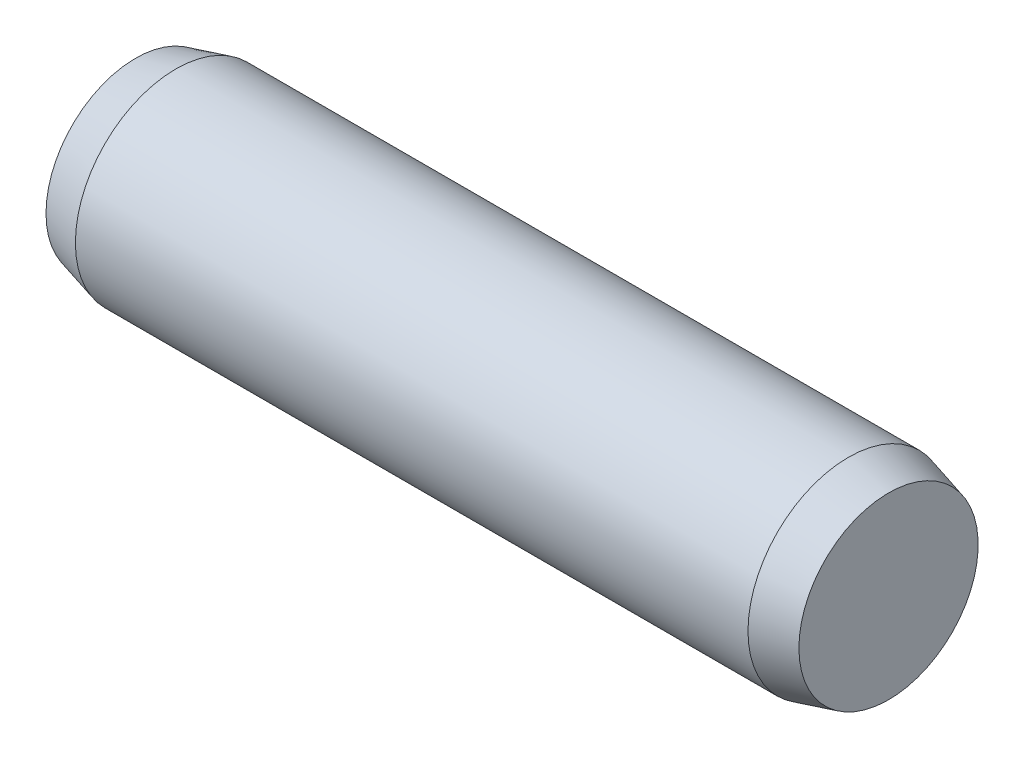
from build123d import *


with BuildPart() as part:
    # Sketch1 → Base-Revolve (revolve)
    with BuildSketch(Plane.XY, mode=Mode.PRIVATE) as base_revolve_sk:
        Polygon((0, 0), (3, 0), (3, 0.357128129), (2.84, 0.4), (0.16, 0.4), (0, 0.357128129), align=None)
    revolve(base_revolve_sk.sketch.rotate(Axis((-1.655717266, 0, 0), (1, 0, 0)), 90), axis=Axis((-1.655717266, 0, 0), (1, 0, 0)))


solid = part.part
